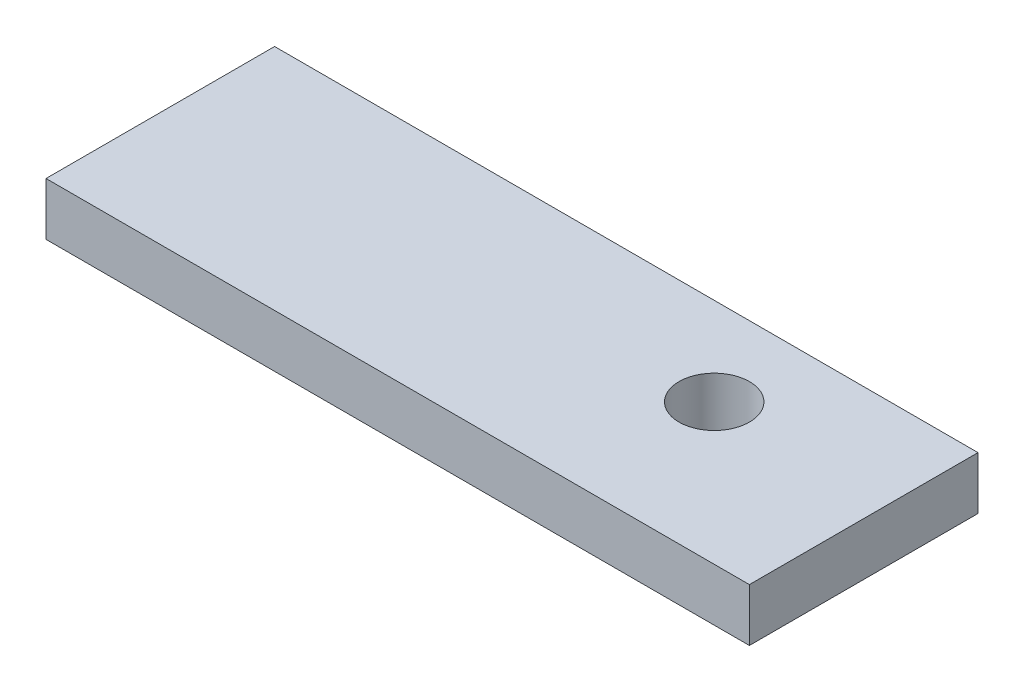
from build123d import *

# Parameters (mm, degrees)
SKETCH1_7_W         = 40
SKETCH1_7_H         = 13
SKETCH1_7_R         = 2
BOSS_EXTRUDE4_DEPTH = 3


with BuildPart() as part:
    # Sketch1<7> → Boss-Extrude4 (new body)
    with BuildSketch(Plane(origin=(0, 0, 0), x_dir=(1, 0, 0), z_dir=(0, 1, 0))):
        with Locations((132.296761578, -20.469822669)):
            Rectangle(SKETCH1_7_W, SKETCH1_7_H)
        with Locations((142.296761578, -18.969822669)):
            Circle(SKETCH1_7_R, mode=Mode.SUBTRACT)
    extrude(amount=BOSS_EXTRUDE4_DEPTH)


solid = part.part
